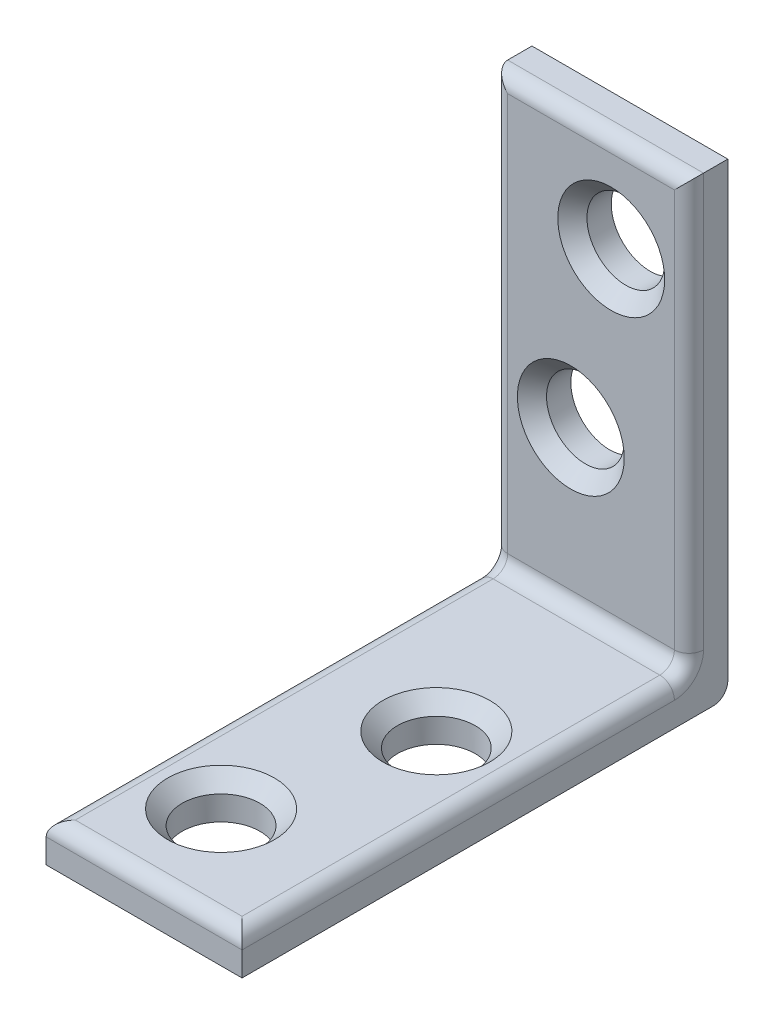
from build123d import *

# Parameters (mm, degrees)
SKETCH1_W           = 16.002
SKETCH1_H           = 38.1
BOSS_EXTRUDE1_DEPTH = 3.175
SKETCH2_W           = 16.002
SKETCH2_H           = 3.175
BOSS_EXTRUDE2_DEPTH = 38.1
SKETCH3_R           = 3.175
CUT_EXTRUDE1_DEPTH  = 56.143781701
SKETCH4_R           = 3.175
CUT_EXTRUDE2_DEPTH  = 56.235109172
CHAMFER1_SIZE       = 1.190625
FILLET1_R           = 1.190625


with BuildPart() as part:
    # Sketch1 → Boss-Extrude1 (new body)
    with BuildSketch(Plane(origin=(0, 0, 0), x_dir=(1, 0, 0), z_dir=(0, 1, 0))):
        with Locations((8.001, 19.05)):
            Rectangle(SKETCH1_W, SKETCH1_H)
    extrude(amount=BOSS_EXTRUDE1_DEPTH)

    # Sketch2 → Boss-Extrude2 (add)
    with BuildSketch(Plane.XZ):
        with Locations((8.001, -38.1)):
            Rectangle(SKETCH2_W, SKETCH2_H)
    extrude(amount=-BOSS_EXTRUDE2_DEPTH)

    # Sketch3 → Cut-Extrude1 (cut, through all)
    with BuildSketch(Plane.XY.offset(-36.5125)):
        with Locations((9.652, 30.1625)):
            Circle(SKETCH3_R)
        with Locations((6.35, 15.875)):
            Circle(SKETCH3_R)
    extrude(amount=-CUT_EXTRUDE1_DEPTH, mode=Mode.SUBTRACT)

    # Sketch4 → Cut-Extrude2 (cut, through all)
    with BuildSketch(Plane(origin=(0, 3.175, 0), x_dir=(1, 0, 0), z_dir=(0, 1, 0))):
        with Locations(Location((9.652, 22.225, 0), (0, 0, 270))):
            Circle(SKETCH4_R)
        with Locations(Location((6.35, 7.9375, 0), (0, 0, 270))):
            Circle(SKETCH4_R)
    extrude(amount=-CUT_EXTRUDE2_DEPTH, mode=Mode.SUBTRACT)

    # Chamfer1
    chamfer1_edges = [part.edges().sort_by_distance(p)[0] for p in [
        (6.477, 30.1625, -36.5125),
        (3.175, 15.875, -36.5125),
        (9.652, 3.175, -25.4),
        (6.35, 3.175, -11.1125),
    ]]
    chamfer(chamfer1_edges, length=CHAMFER1_SIZE)

    # Fillet1
    fillet1_edges = [part.edges().sort_by_distance(p)[0] for p in [
        (16.002, 3.175, -18.25625),
        (0, 3.175, -18.25625),
        (8.001, 0, -39.6875),
        (8.001, 38.1, -36.5125),
        (0, 20.6375, -36.5125),
        (16.002, 20.6375, -36.5125),
        (8.001, 3.175, -36.5125),
        (8.001, 3.175, 0),
    ]]
    fillet(fillet1_edges, radius=FILLET1_R)


solid = part.part
